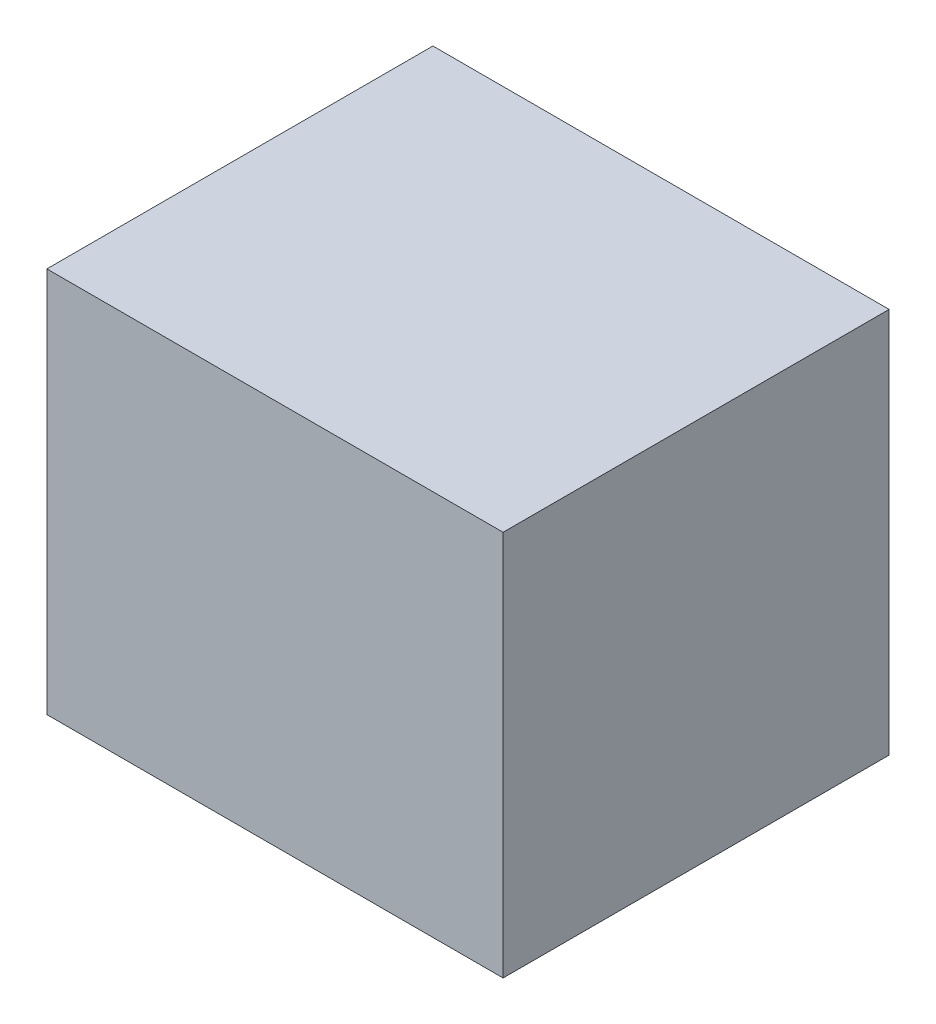
from build123d import *

# Parameters (mm, degrees)
SKETCH2_W                     = 650
SKETCH2_H                     = 550
BOSS_EXTRUDE1_DEPTH           = 550
BOSS_EXTRUDE1_OTHER_WAY_DEPTH = 30
BOSS_EXTRUDE1_OTHER_WAY_TAPER = 45


with BuildPart() as part:
    # Sketch2 → Boss-Extrude1 (new body)
    with BuildSketch(Plane.XY):
        Rectangle(SKETCH2_W, SKETCH2_H)
    extrude(amount=BOSS_EXTRUDE1_DEPTH)

    # Sketch2 → Boss-Extrude1 other way (add)
    with BuildSketch(Plane.XY):
        Rectangle(SKETCH2_W, SKETCH2_H)
    extrude(amount=-BOSS_EXTRUDE1_OTHER_WAY_DEPTH, taper=BOSS_EXTRUDE1_OTHER_WAY_TAPER)


solid = part.part
